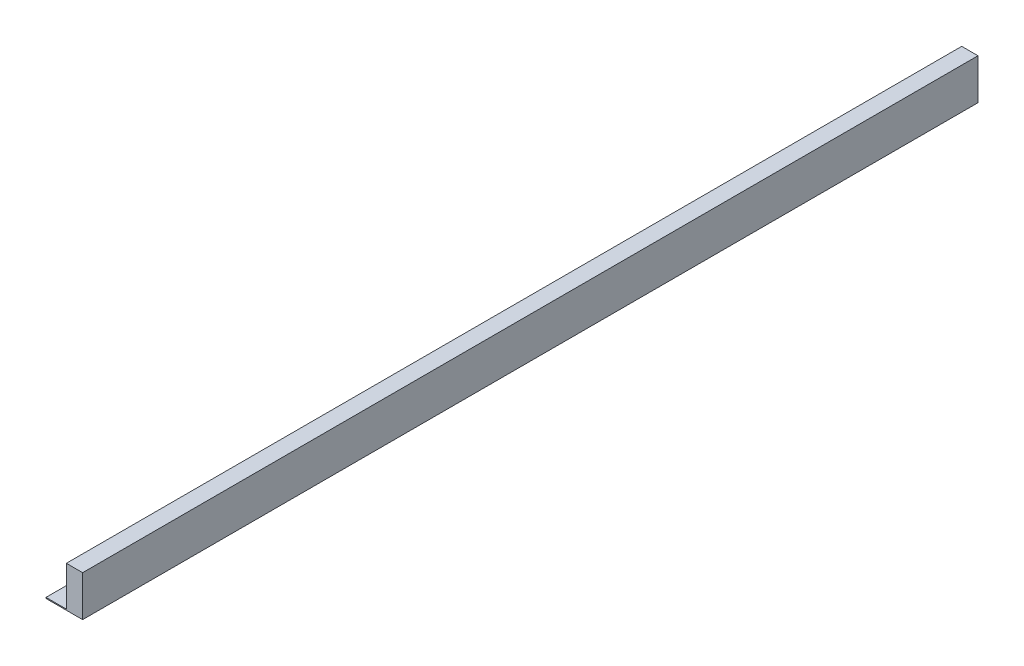
from build123d import *

# Parameters (mm, degrees)
SKETCH1_W           = 12.7
SKETCH1_H           = 30.48
BOSS_EXTRUDE1_DEPTH = 558.8
SKETCH2_OUTSIDE_W   = 126.654
SKETCH2_OUTSIDE_H   = 144.434
SKETCH2_OUTSIDE_W_2 = 10.16
SKETCH2_OUTSIDE_H_2 = 25.4
CUT_EXTRUDE1_DEPTH  = 560.043844524
SKETCH3_W           = 12.7
SKETCH3_H           = 0.635
BOSS_EXTRUDE2_DEPTH = 558.8


with BuildPart() as part:
    # Sketch1 → Boss-Extrude1 (new body)
    with BuildSketch(Plane.XY):
        Rectangle(SKETCH1_W, SKETCH1_H)
    extrude(amount=BOSS_EXTRUDE1_DEPTH)

    # Sketch2 outside → Cut-Extrude1 (cut, through all)
    with BuildSketch(Plane.XY.offset(558.8)):
        Rectangle(SKETCH2_OUTSIDE_W, SKETCH2_OUTSIDE_H)
        with Locations((-1.27, 0)):
            Rectangle(SKETCH2_OUTSIDE_W_2, SKETCH2_OUTSIDE_H_2, mode=Mode.SUBTRACT)
    extrude(amount=-CUT_EXTRUDE1_DEPTH, mode=Mode.SUBTRACT)

    # Sketch3 → Boss-Extrude2 (add)
    with BuildSketch(Plane.XY):
        with Locations((-12.7, -12.3825)):
            Rectangle(SKETCH3_W, SKETCH3_H)
    extrude(amount=BOSS_EXTRUDE2_DEPTH)


solid = part.part
